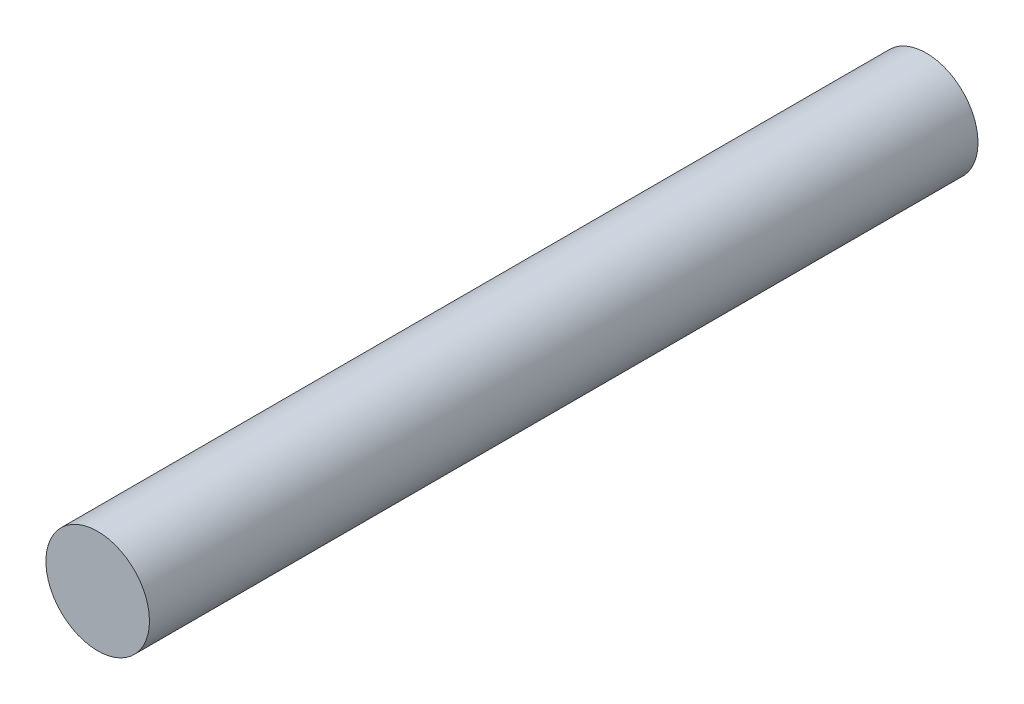
from build123d import *

# Parameters (mm, degrees)
SKETCH3_R           = 1.5875
BOSS_EXTRUDE1_DEPTH = 25.4


with BuildPart() as part:
    # Sketch3 → Boss-Extrude1 (new body)
    with BuildSketch(Plane.XY):
        Circle(SKETCH3_R)
    extrude(amount=BOSS_EXTRUDE1_DEPTH)


solid = part.part
